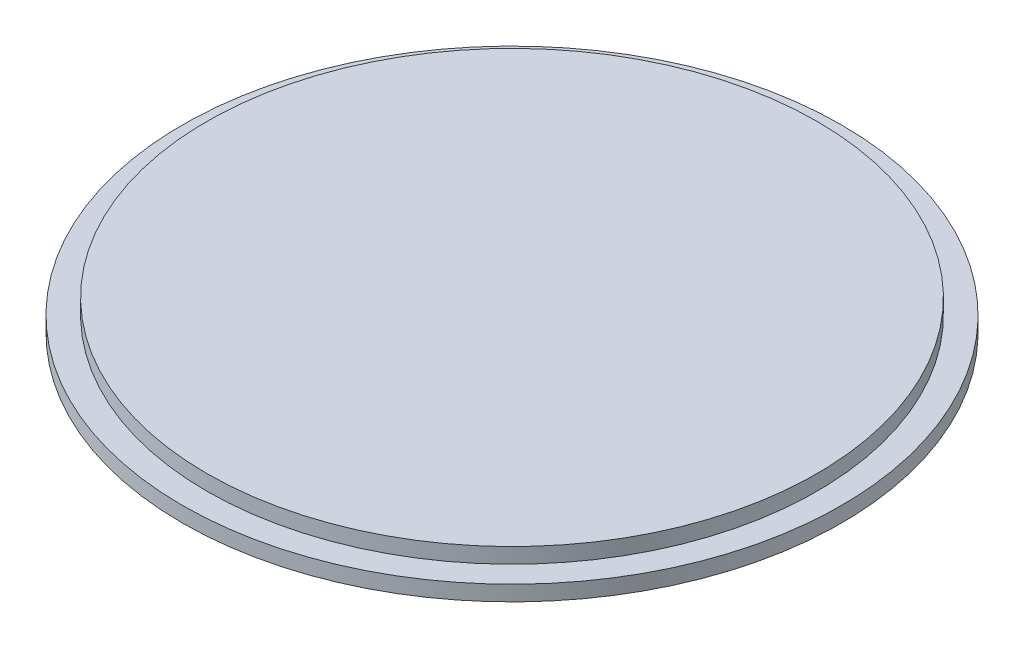
from build123d import *

# Parameters (mm, degrees)
SKETCH1_R           = 68.326
BOSS_EXTRUDE1_DEPTH = 3.175
SKETCH2_R           = 63.246
BOSS_EXTRUDE2_DEPTH = 3.175


with BuildPart() as part:
    # Sketch1 → Boss-Extrude1 (new body)
    with BuildSketch(Plane(origin=(0, 0, 0), x_dir=(1, 0, 0), z_dir=(0, 1, 0))):
        with Locations(Location((0, 0, 0), (0, 0, 270))):
            Circle(SKETCH1_R)
    extrude(amount=BOSS_EXTRUDE1_DEPTH)

    # Sketch2 → Boss-Extrude2 (add)
    with BuildSketch(Plane(origin=(0, 3.175, 0), x_dir=(1, 0, 0), z_dir=(0, 1, 0))):
        with Locations(Location((0, 0, 0), (0, 0, 270))):
            Circle(SKETCH2_R)
    extrude(amount=BOSS_EXTRUDE2_DEPTH)


solid = part.part
